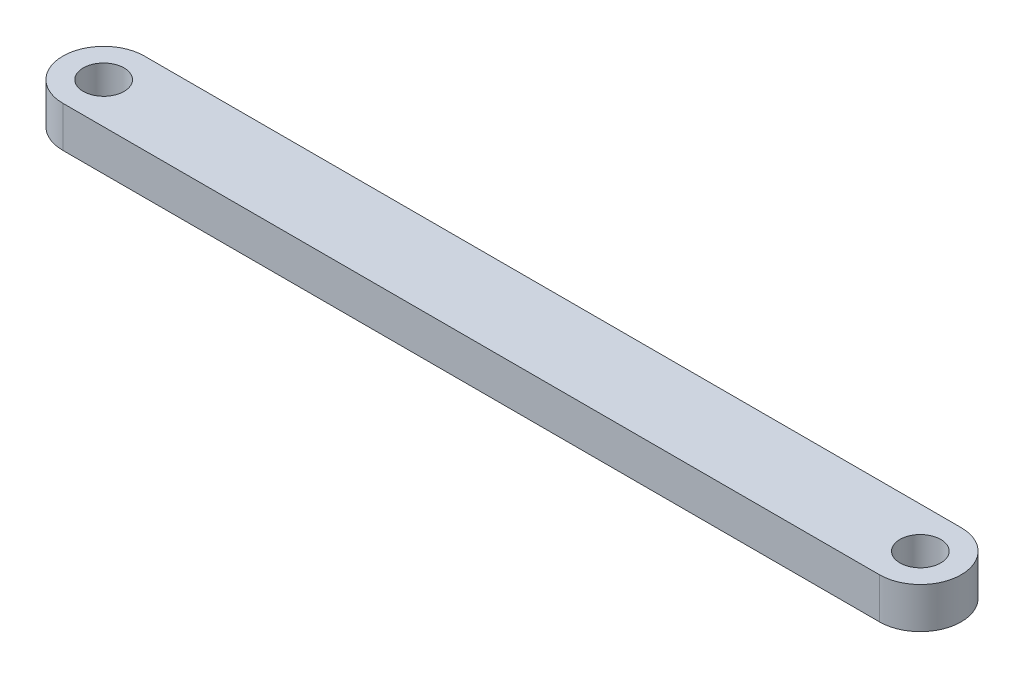
from build123d import *

# Parameters (mm, degrees)
EXTRUDE_1_DEPTH     = 5
SKETCH_2_R          = 2.5
CUT_EXTRUDE_1_DEPTH = 5


with BuildPart() as part:
    # 스케치1 → 보스-돌출1 (new body)
    with BuildSketch(Plane(origin=(0, 0, 0), x_dir=(1, 0, 0), z_dir=(0, 1, 0))):
        with BuildLine():
            Line((0, 5), (100, 5))
            ThreePointArc((100, 5), (105, 0), (100, -5))
            Line((100, -5), (0, -5))
            ThreePointArc((0, -5), (-5, 0), (0, 5))
        make_face()
    extrude(amount=EXTRUDE_1_DEPTH)

    # 스케치2 → 컷-돌출1 (cut)
    with BuildSketch(Plane(origin=(0, 5, 0), x_dir=(1, 0, 0), z_dir=(0, 1, 0))):
        with Locations(Location((0, 0, 0), (0, 0, 270))):
            Circle(SKETCH_2_R)
        with Locations(Location((100, 0, 0), (0, 0, 270))):
            Circle(SKETCH_2_R)
    extrude(amount=-CUT_EXTRUDE_1_DEPTH, mode=Mode.SUBTRACT)


solid = part.part
